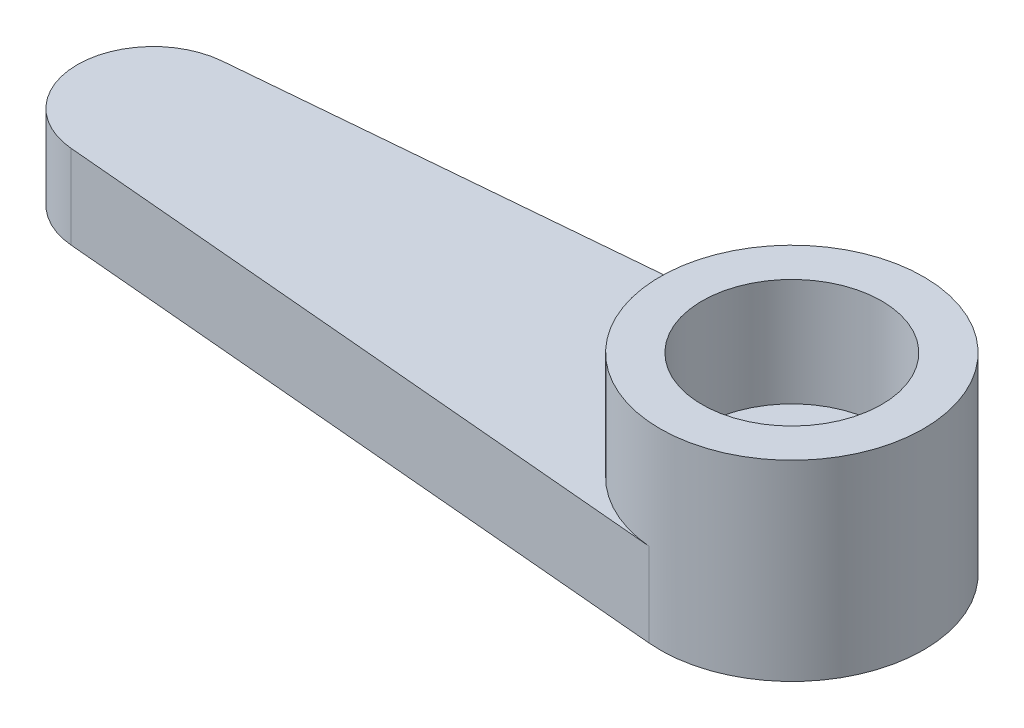
from build123d import *

# Parameters (mm, degrees)
EXTRUDE_1_DEPTH     = 2.1
SKETCH_3_R          = 3.3
SKETCH_3_R_2        = 2.25
EXTRUDE_2_DEPTH     = 2.7
SKETCH_5_R          = 1.2
CUT_EXTRUDE_1_DEPTH = 2.7


with BuildPart() as part:
    # 草图2 → 凸台-拉伸1 (new body)
    with BuildSketch(Plane(origin=(0, 0, 0), x_dir=(1, 0, 0), z_dir=(0, 1, 0))):
        with BuildLine():
            Line((-16.16625, 1.892712587), (-0.28875, 3.287342914))
            ThreePointArc((-0.28875, 3.287342914), (3.3, 0), (-0.28875, -3.287342914))
            Line((-0.28875, -3.287342914), (-16.16625, -1.892712587))
            ThreePointArc((-16.16625, -1.892712587), (-17.9, 0), (-16.16625, 1.892712587))
        make_face()
    extrude(amount=EXTRUDE_1_DEPTH)

    # 草图3 → 凸台-拉伸2 (add)
    with BuildSketch(Plane(origin=(0, 2.1, 0), x_dir=(1, 0, 0), z_dir=(0, 1, 0))):
        with Locations(Location((0, 0, 0), (0, 0, 95.019800132))):
            Circle(SKETCH_3_R)
        with Locations(Location((0, 0, 0), (0, 0, 90))):
            Circle(SKETCH_3_R_2, mode=Mode.SUBTRACT)
    extrude(amount=EXTRUDE_2_DEPTH)

    # 草图5 → 切除-拉伸1 (cut)
    with BuildSketch(Plane(origin=(0, 2.1, 0), x_dir=(1, 0, 0), z_dir=(0, 1, 0))):
        with Locations(Location((0, 0, 0), (0, 0, 270))):
            Circle(SKETCH_5_R)
    extrude(amount=-CUT_EXTRUDE_1_DEPTH, mode=Mode.SUBTRACT)


solid = part.part
